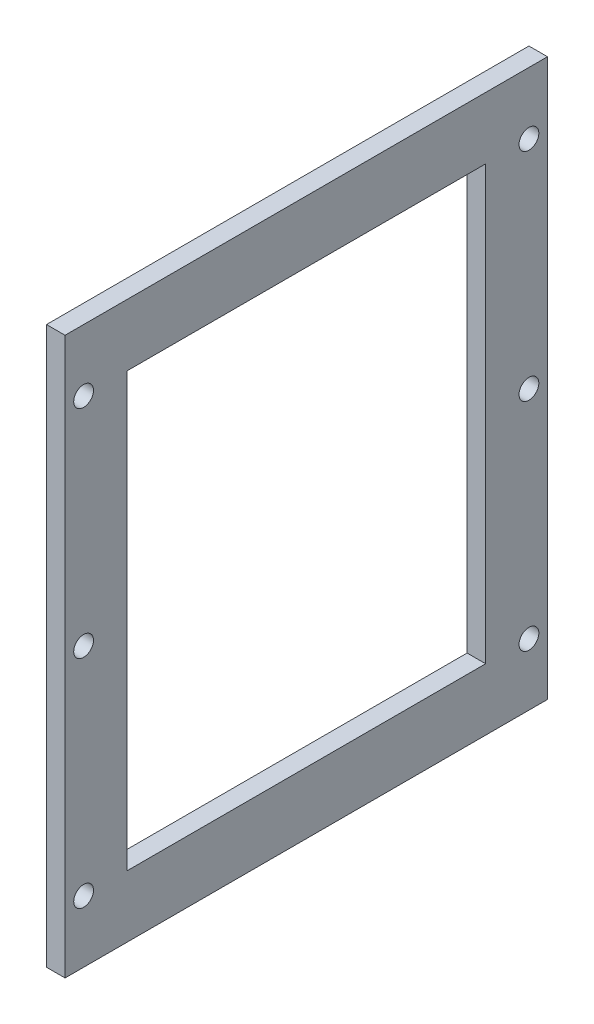
from build123d import *

# Parameters (mm, degrees)
SKETCH_1_W      = 390
SKETCH_1_H      = 450
SKETCH_1_R      = 8
SKETCH_1_W_2    = 290
SKETCH_1_H_2    = 350
EXTRUDE_1_DEPTH = 15


with BuildPart() as part:
    # 草图1 → 凸台-拉伸1 (new body)
    with BuildSketch(Plane(origin=(0, 0, 0), x_dir=(0, 0, -1), z_dir=(1, 0, 0))):
        Rectangle(SKETCH_1_W, SKETCH_1_H)
        with Locations((-180, 175)):
            Circle(SKETCH_1_R, mode=Mode.SUBTRACT)
        with Locations(Location((-180, -175, 0), (0, 0, 180))):
            Circle(SKETCH_1_R, mode=Mode.SUBTRACT)
        with Locations((-180, 0)):
            Circle(SKETCH_1_R, mode=Mode.SUBTRACT)
        with Locations(Location((180, 175, 0), (0, 0, 180))):
            Circle(SKETCH_1_R, mode=Mode.SUBTRACT)
        with Locations(Location((180, 0, 0), (0, 0, 180))):
            Circle(SKETCH_1_R, mode=Mode.SUBTRACT)
        with Locations((180, -175)):
            Circle(SKETCH_1_R, mode=Mode.SUBTRACT)
        Rectangle(SKETCH_1_W_2, SKETCH_1_H_2, mode=Mode.SUBTRACT)
    extrude(amount=EXTRUDE_1_DEPTH)


solid = part.part
